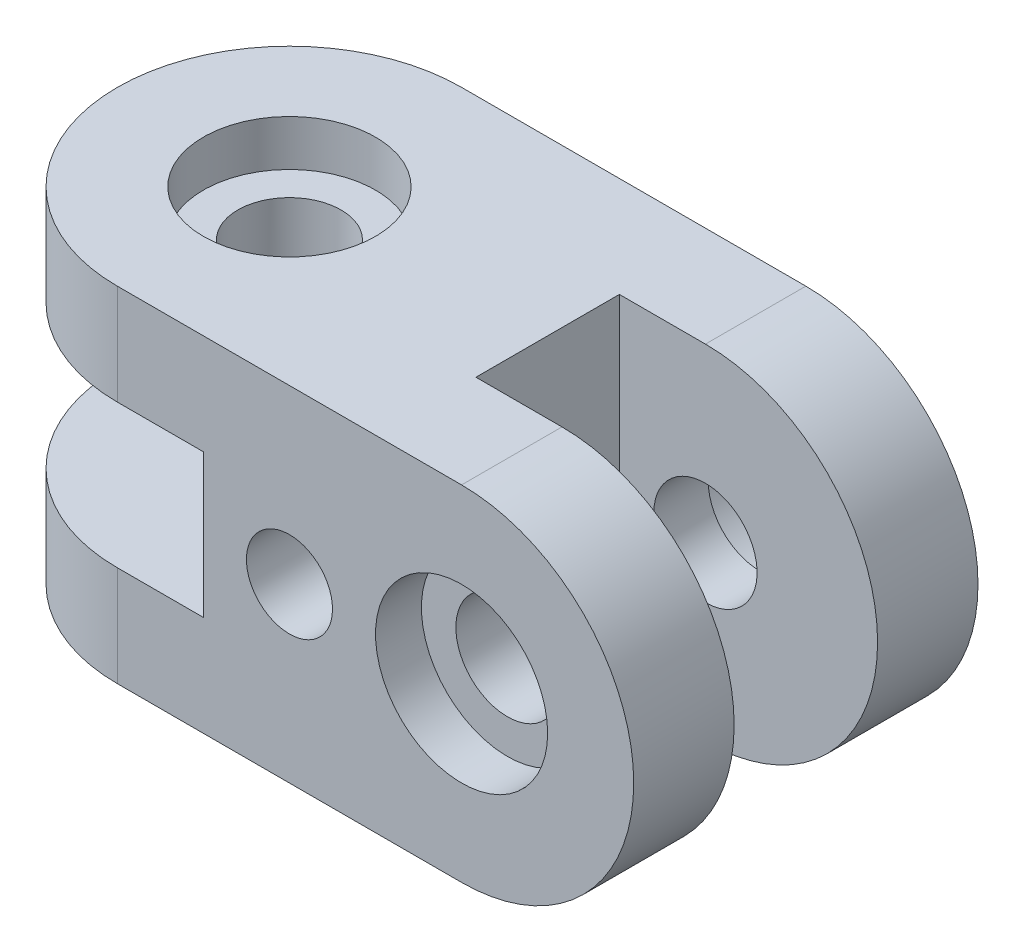
from build123d import *

# Parameters (mm, degrees)
BOSS_EXTRUDE1_DEPTH     = 30
CUT_EXTRUDE1_DEPTH      = 74.484692283
CUT_EXTRUDE1_DEPTH_BACK = 74.484692283
SKETCH3_R               = 7.5
CUT_EXTRUDE2_DEPTH      = 91
CUT_EXTRUDE2_DEPTH_BACK = 91
SKETCH5_R               = 15
CUT_EXTRUDE3_DEPTH      = 8
CUT_EXTRUDE4_REACH      = 86.876
SKETCH6_R               = 9
CUT_EXTRUDE5_DEPTH      = 74.484692283
CUT_EXTRUDE5_DEPTH_BACK = 74.484692283
SKETCH7_W               = 45
SKETCH7_H               = 25
SKETCH8_R               = 15
CUT_EXTRUDE6_DEPTH      = 8
CUT_EXTRUDE7_REACH      = 86.876
SKETCH9_R               = 9


with BuildPart() as part:
    # Sketch1 → Boss-Extrude1 (new, symmetric)
    with BuildSketch(Plane.XY):
        with BuildLine():
            Line((-60, 12.5), (-60, 30))
            Line((-60, 30), (30, 30))
            ThreePointArc((30, 30), (60, 0), (30, -30))
            Line((30, -30), (-60, -30))
            Line((-60, -30), (-60, -12.5))
            Line((-60, -12.5), (-15, -12.5))
            Line((-15, -12.5), (-15, 12.5))
            Line((-15, 12.5), (-60, 12.5))
        make_face()
    extrude(amount=BOSS_EXTRUDE1_DEPTH, both=True)

    # Sketch3 → Cut-Extrude1 (cut, two sides: drawn at the far end of the back side and taken through both)
    with BuildSketch(Plane.XY.offset(-CUT_EXTRUDE1_DEPTH_BACK)):
        Circle(SKETCH3_R)
    extrude(amount=CUT_EXTRUDE1_DEPTH + CUT_EXTRUDE1_DEPTH_BACK, mode=Mode.SUBTRACT)

    # Sketch4 → Cut-Extrude2 (cut, two sides: drawn at the far end of the back side and taken through both)
    with BuildSketch(Plane(origin=(0, 30, 0), x_dir=(1, 0, 0), z_dir=(0, 1, 0)).offset(-CUT_EXTRUDE2_DEPTH_BACK)):
        with BuildLine():
            Line((-30, 30), (-30, 42.770577687))
            Line((-30, 42.770577687), (-70.432292605, 42.770577687))
            Line((-70.432292605, 42.770577687), (-70.432292605, -35.727348426))
            Line((-70.432292605, -35.727348426), (-30, -35.727348426))
            Line((-30, -35.727348426), (-30, -30))
            ThreePointArc((-30, -30), (-60, 0), (-30, 30))
        make_face()
    extrude(amount=CUT_EXTRUDE2_DEPTH + CUT_EXTRUDE2_DEPTH_BACK, mode=Mode.SUBTRACT)

    # Sketch5 → Cut-Extrude3 (cut)
    with BuildSketch(Plane(origin=(0, 30, 0), x_dir=(1, 0, 0), z_dir=(0, 1, 0))):
        with Locations(Location((-30, 0, 0), (0, 0, 270))):
            Circle(SKETCH5_R)
    cut_extrude3 = extrude(amount=-CUT_EXTRUDE3_DEPTH, mode=Mode.SUBTRACT)

    # Sketch6 → Cut-Extrude4 (cut, up to next)
    with BuildSketch(Plane(origin=(0, 22, 0), x_dir=(1, 0, 0), z_dir=(0, 1, 0)), mode=Mode.PRIVATE) as cut_extrude4_sk1:
        with Locations(Location((-30, 0, 0), (0, 0, 270))):
            Circle(SKETCH6_R)
    cut_extrude4_tool1 = extrude(cut_extrude4_sk1.sketch, amount=-CUT_EXTRUDE4_REACH, mode=Mode.PRIVATE) & part.part
    cut_extrude4 = cut_extrude4_tool1.solids().sort_by_distance((-30, 22, 0))[0]
    add(cut_extrude4, mode=Mode.SUBTRACT)

    # Mirror1: Cut-Extrude3, Cut-Extrude4 across plane
    add(cut_extrude3.mirror(Plane.ZX), mode=Mode.SUBTRACT)
    add(cut_extrude4.mirror(Plane.ZX), mode=Mode.SUBTRACT)

    # Sketch7 → Cut-Extrude5 (cut, two sides: drawn at the far end of the back side and taken through both)
    with BuildSketch(Plane(origin=(0, 0, 0), x_dir=(1, 0, 0), z_dir=(0, 1, 0)).offset(-CUT_EXTRUDE5_DEPTH_BACK)):
        with Locations((37.5, 0)):
            Rectangle(SKETCH7_W, SKETCH7_H)
    extrude(amount=CUT_EXTRUDE5_DEPTH + CUT_EXTRUDE5_DEPTH_BACK, mode=Mode.SUBTRACT)

    # Sketch8 → Cut-Extrude6 (cut)
    with BuildSketch(Plane.XY.offset(30)):
        with Locations((30, 0)):
            Circle(SKETCH8_R)
    cut_extrude6 = extrude(amount=-CUT_EXTRUDE6_DEPTH, mode=Mode.SUBTRACT)

    # Sketch9 → Cut-Extrude7 (cut, up to next)
    with BuildSketch(Plane.XY.offset(22), mode=Mode.PRIVATE) as cut_extrude7_sk1:
        with Locations((30, 0)):
            Circle(SKETCH9_R)
    cut_extrude7_tool1 = extrude(cut_extrude7_sk1.sketch, amount=-CUT_EXTRUDE7_REACH, mode=Mode.PRIVATE) & part.part
    cut_extrude7 = cut_extrude7_tool1.solids().sort_by_distance((30, 0, 22))[0]
    add(cut_extrude7, mode=Mode.SUBTRACT)

    # Mirror2: Cut-Extrude6, Cut-Extrude7 across plane
    add(cut_extrude6.mirror(Plane.XY), mode=Mode.SUBTRACT)
    add(cut_extrude7.mirror(Plane.XY), mode=Mode.SUBTRACT)


solid = part.part
